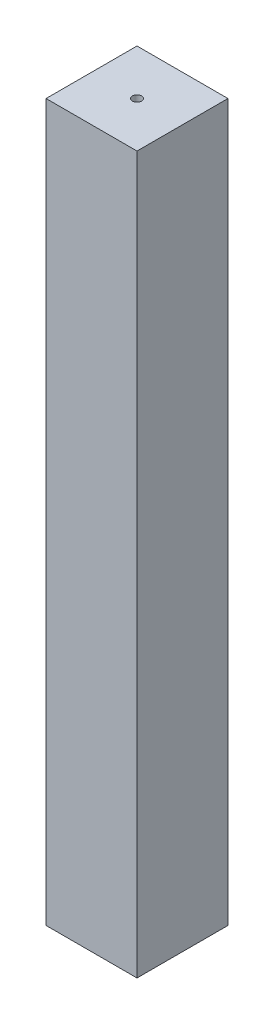
from build123d import *

# Parameters (mm, degrees)
SKETCH1_W                  = 50.8
SKETCH1_H                  = 50.8
BOSS_EXTRUDE1_DEPTH        = 400.05
F_10_CLEARANCE_HOLE1_D     = 5.1054
F_10_CLEARANCE_HOLE1_DEPTH = 25.4
F_10_CLEARANCE_HOLE1_TIP   = 1.533816902


with BuildPart() as part:
    # Sketch1 → Boss-Extrude1 (new body)
    with BuildSketch(Plane(origin=(0, 0, 0), x_dir=(1, 0, 0), z_dir=(0, 1, 0))):
        Rectangle(SKETCH1_W, SKETCH1_H)
    extrude(amount=BOSS_EXTRUDE1_DEPTH)

    # #10 Clearance Hole1
    with Locations(Plane(origin=(0, 400.05, 0), x_dir=(1, 0, 0), z_dir=(0, 1, 0))):
        with Locations((0, 0)):
            Hole(F_10_CLEARANCE_HOLE1_D / 2, depth=F_10_CLEARANCE_HOLE1_DEPTH)
            with Locations((0, 0, -(F_10_CLEARANCE_HOLE1_DEPTH + F_10_CLEARANCE_HOLE1_TIP / 2))):  # 118° drill point
                Cone(0, F_10_CLEARANCE_HOLE1_D / 2, F_10_CLEARANCE_HOLE1_TIP, mode=Mode.SUBTRACT)


solid = part.part
